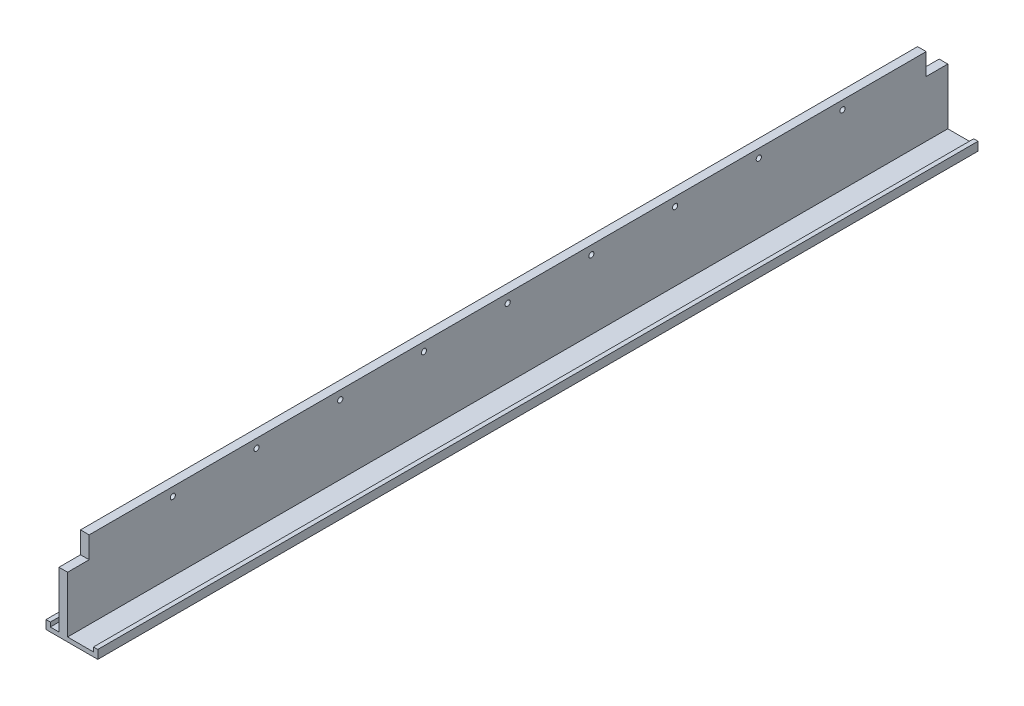
from build123d import *

# Parameters (mm, degrees)
BOSS_EXTRUDE1_DEPTH = 1020
SKETCH2_W           = 25
SKETCH2_H           = 25
CUT_EXTRUDE1_DEPTH  = 10
SKETCH3_R           = 3
CUT_EXTRUDE2_DEPTH  = 10
LPATTERN1_COUNT     = 9
LPATTERN1_PITCH     = 97


with BuildPart() as part:
    # Sketch1 → Boss-Extrude1 (new body)
    with BuildSketch(Plane.XY):
        Polygon((0, 10), (0, 0), (60, 0), (60, 10), (55, 10), (55, 5), (25, 5), (25, 95), (15, 95), (15, 5), (5, 5), (5, 10), align=None)
    extrude(amount=BOSS_EXTRUDE1_DEPTH)

    # Sketch2 → Cut-Extrude1 (cut)
    with BuildSketch(Plane(origin=(25, 0, 0), x_dir=(0, 0, -1), z_dir=(1, 0, 0))):
        with Locations((-1007.5, 82.5)):
            Rectangle(SKETCH2_W, SKETCH2_H)
        with Locations((-12.5, 82.5)):
            Rectangle(SKETCH2_W, SKETCH2_H)
    extrude(amount=-CUT_EXTRUDE1_DEPTH, mode=Mode.SUBTRACT)

    # Sketch3 → Cut-Extrude2 (cut)
    with BuildSketch(Plane(origin=(25, 0, 0), x_dir=(0, 0, -1), z_dir=(1, 0, 0))):
        with Locations(Location((-898, 85, 0), (0, 0, 90))):
            Circle(SKETCH3_R)
    cut_extrude2 = extrude(amount=-CUT_EXTRUDE2_DEPTH, mode=Mode.SUBTRACT)

    # LPattern1: Cut-Extrude2 ×9
    with Locations(*[(0, 0, -i * LPATTERN1_PITCH) for i in range(1, LPATTERN1_COUNT)]):
        add(cut_extrude2, mode=Mode.SUBTRACT)


solid = part.part
